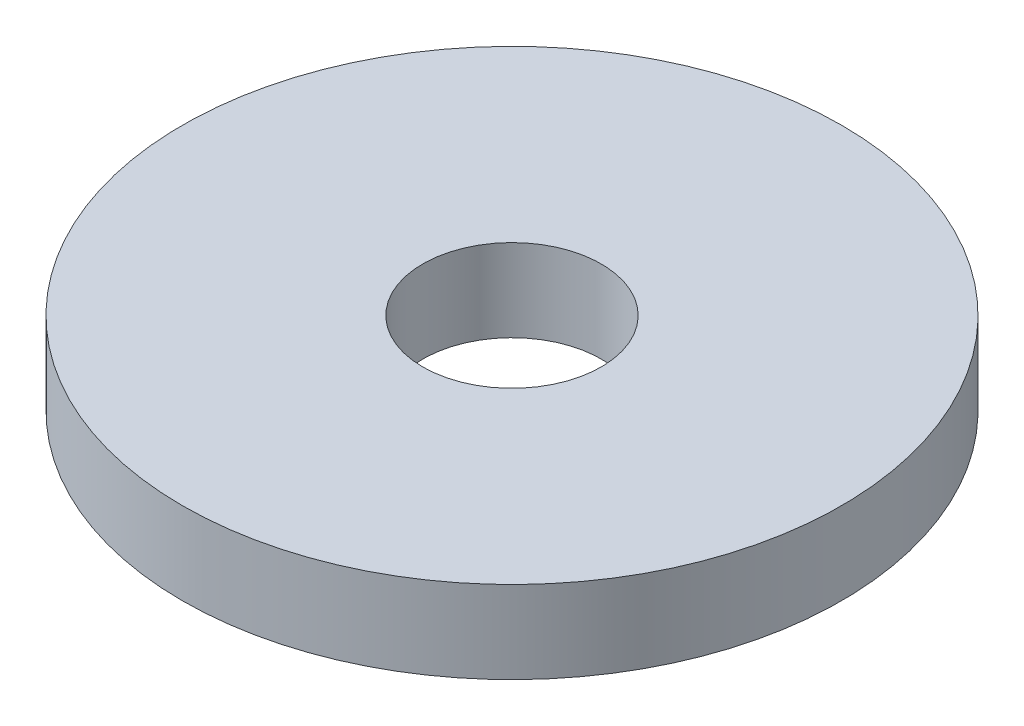
from build123d import *

# Parameters (mm, degrees)
SKETCH1_R           = 12
SKETCH1_R_2         = 3.25
BOSS_EXTRUDE1_DEPTH = 1.5


with BuildPart() as part:
    # Sketch1 → Boss-Extrude1 (new, symmetric)
    with BuildSketch(Plane(origin=(0, 0, 0), x_dir=(1, 0, 0), z_dir=(0, 1, 0))):
        with Locations(Location((0, 0, 0), (0, 0, 270))):
            Circle(SKETCH1_R)
        with Locations(Location((0, 0, 0), (0, 0, 270))):
            Circle(SKETCH1_R_2, mode=Mode.SUBTRACT)
    extrude(amount=BOSS_EXTRUDE1_DEPTH, both=True)


solid = part.part
